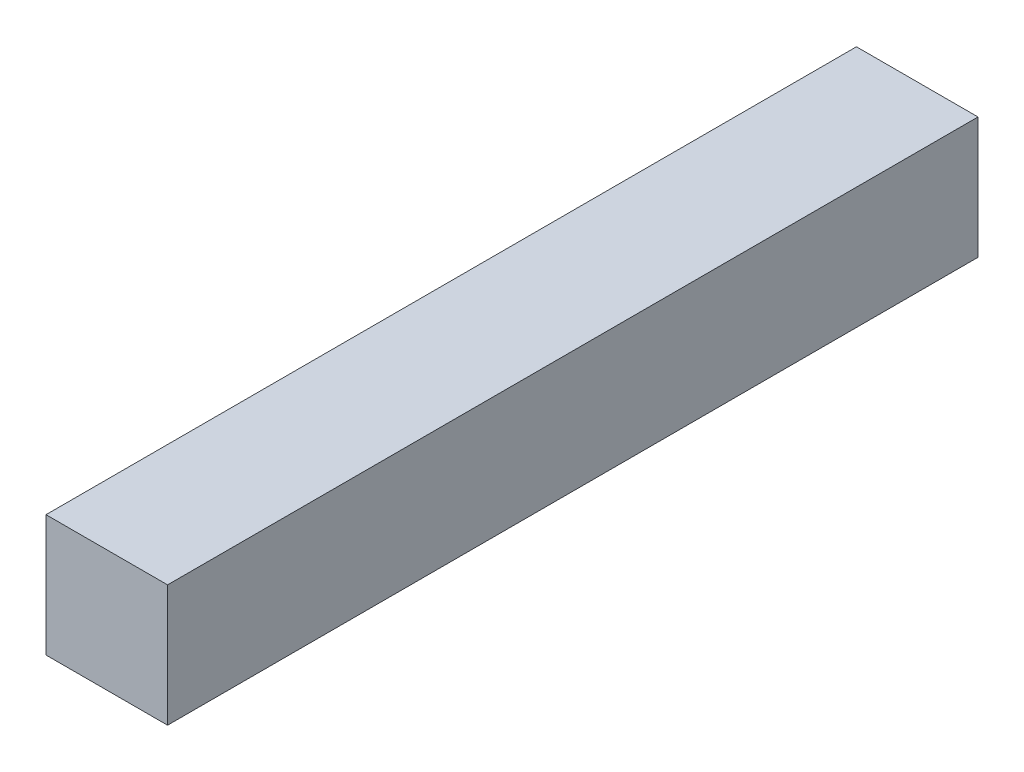
from build123d import *

# Parameters (mm, degrees)
SKETCH1_W           = 7.62
SKETCH1_H           = 7.62
BOSS_EXTRUDE1_DEPTH = 50.8


with BuildPart() as part:
    # Sketch1 → Boss-Extrude1 (new body)
    with BuildSketch(Plane.XY):
        with Locations((0.762, -1.233714286)):
            Rectangle(SKETCH1_W, SKETCH1_H)
    extrude(amount=BOSS_EXTRUDE1_DEPTH)


solid = part.part
